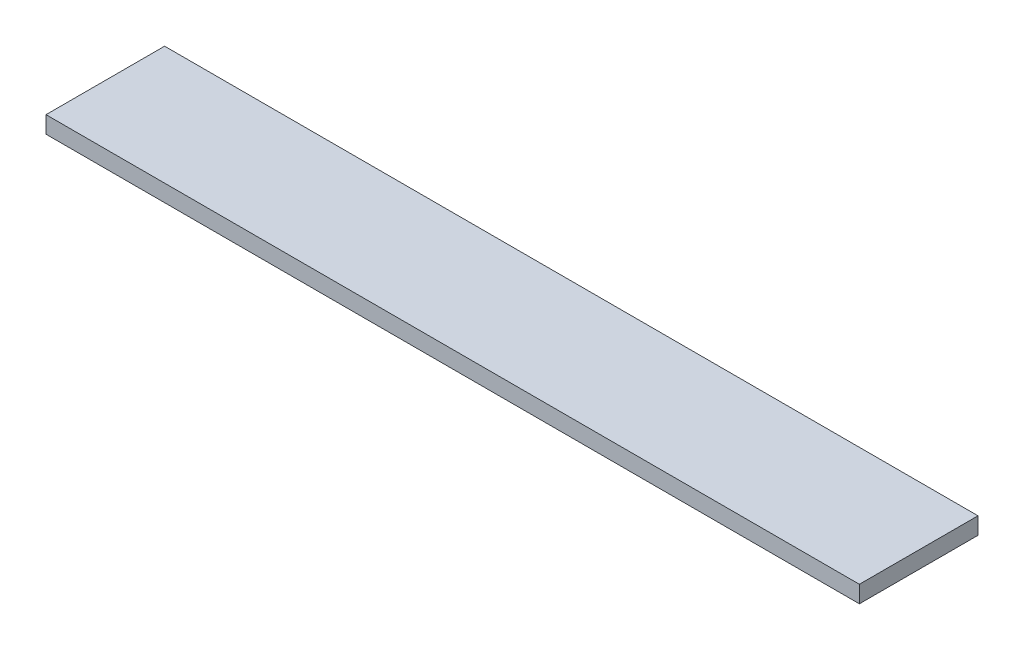
from build123d import *

# Parameters (mm, degrees)
SKETCH1_W           = 609.6
SKETCH1_H           = 88.9
BOSS_EXTRUDE1_DEPTH = 12.7


with BuildPart() as part:
    # Sketch1 → Boss-Extrude1 (new body)
    with BuildSketch(Plane(origin=(0, 0, 0), x_dir=(1, 0, 0), z_dir=(0, 1, 0))):
        with Locations((0, -44.45)):
            Rectangle(SKETCH1_W, SKETCH1_H)
    extrude(amount=-BOSS_EXTRUDE1_DEPTH)


solid = part.part
